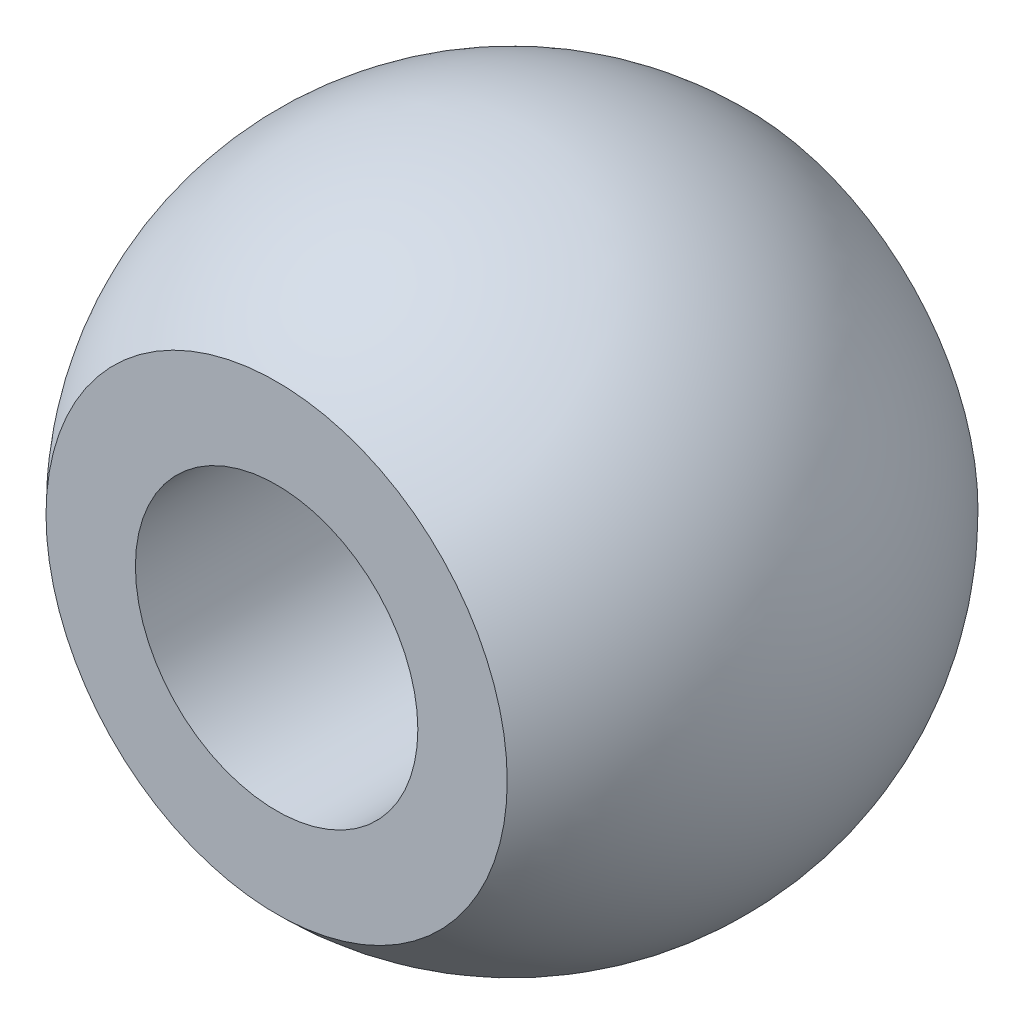
from build123d import *

# Parameters (mm, degrees)
SKETCH_3_W               = 11.913892781
SKETCH_3_H               = 10.061659938
CUT_EXTRUDE_1_DEPTH      = 10
CUT_EXTRUDE_2_DEPTH      = 7.062177826
CUT_EXTRUDE_2_DEPTH_BACK = 7.062177826
SKETCH_4_R               = 1.5


with BuildPart() as part:
    # ｽｹｯﾁ1 → 回転1 (revolve)
    with BuildSketch(Plane.XY):
        with BuildLine():
            ThreePointArc((0, 3.5), (3.5, 0), (0, -3.5))
            Line((0, -3.5), (0, 3.5))
        make_face()
    revolve(axis=Axis((0, 3.5, 0), (0, -1, 0)))

    # ｽｹｯﾁ3 → ｶｯﾄ - 押し出し1 (cut)
    with BuildSketch(Plane.XY.offset(2.5)):
        with Locations((0.254670003, 0.204868074)):
            Rectangle(SKETCH_3_W, SKETCH_3_H)
    cut_extrude_1 = extrude(amount=CUT_EXTRUDE_1_DEPTH, mode=Mode.SUBTRACT)

    # ﾐﾗｰ1: ｶｯﾄ - 押し出し1 across plane
    add(cut_extrude_1.mirror(Plane.XY), mode=Mode.SUBTRACT)

    # ｽｹｯﾁ4 → ｶｯﾄ - 押し出し2 (cut, two sides: drawn at the far end of the back side and taken through both)
    with BuildSketch(Plane.XY.offset(-CUT_EXTRUDE_2_DEPTH_BACK)):
        Circle(SKETCH_4_R)
    extrude(amount=CUT_EXTRUDE_2_DEPTH + CUT_EXTRUDE_2_DEPTH_BACK, mode=Mode.SUBTRACT)


solid = part.part
